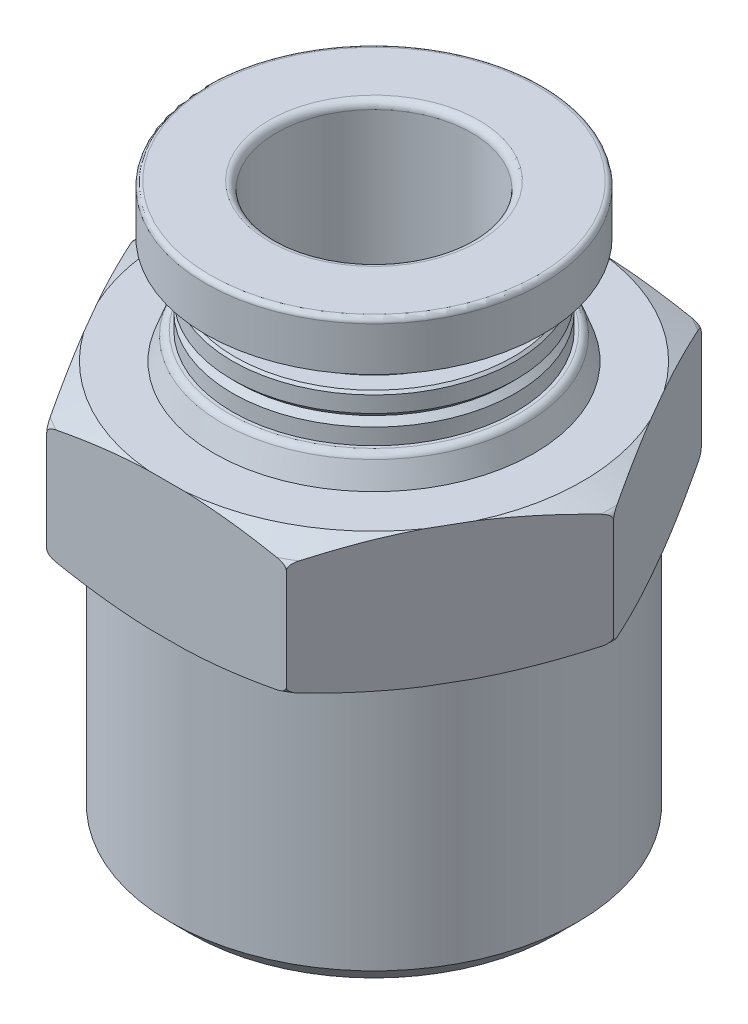
from build123d import *

# Parameters (mm, degrees)
SKETCH_2_R          = 11.814954576
CUT_EXTRUDE_1_DEPTH = 23


with BuildPart() as part:
    # 草图1 → 旋转1 (revolve)
    with BuildSketch(Plane.XY, mode=Mode.PRIVATE) as revolve_1_sk:
        with BuildLine():
            Line((3, 5), (3, 0.6))
            Line((3, 0.6), (3.6, 0))
            Line((3.6, 0), (7.475, 0))
            Line((7.475, 0), (8.331, 0.856))
            Line((8.331, 0.856), (8.331, 11))
            Line((8.331, 11), (8.534954576, 11))
            Line((8.534954576, 11), (9.629759606, 11.453483091))
            ThreePointArc((9.629759606, 11.453483091), (9.76439546, 11.563975881), (9.814954576, 11.730646951))
            Line((9.814954576, 11.730646951), (9.814954576, 15.869353049))
            ThreePointArc((9.814954576, 15.869353049), (9.76439546, 16.036024119), (9.629759606, 16.146516909))
            Line((9.629759606, 16.146516909), (8.534954576, 16.6))
            Line((8.534954576, 16.6), (6.55, 16.6))
            Line((6.55, 16.6), (6.215570396, 17.504080695))
            ThreePointArc((6.215570396, 17.504080695), (6.105632697, 17.646195256), (5.934203715, 17.7))
            Line((5.934203715, 17.7), (5.8, 17.7))
            Line((5.8, 17.7), (5.8, 18.36))
            Line((5.8, 18.36), (5.56, 18.6))
            Line((5.56, 18.6), (5.8, 18.84))
            Line((5.8, 18.84), (5.8, 19.5))
            Line((5.8, 19.5), (5.7, 19.6))
            Line((5.7, 19.6), (4.95, 19.6))
            Line((4.95, 19.6), (4.95, 21))
            Line((4.95, 21), (6.9, 21))
            Line((6.9, 21), (6.9, 22.8))
            ThreePointArc((6.9, 22.8), (6.841421356, 22.941421356), (6.7, 23))
            Line((6.7, 23), (4.3, 23))
            ThreePointArc((4.3, 23), (4.087867966, 22.912132034), (4, 22.7))
            Line((4, 22.7), (4, 5))
            Line((4, 5), (3, 5))
        make_face()
    revolve(revolve_1_sk.sketch.rotate(Axis((0, 0, 0), (0, 1, 0)), 270), axis=Axis((0, 0, 0), (0, 1, 0)))

    # 草图2 → 切除-拉伸1 (cut)
    with BuildSketch(Plane(origin=(0, 11, 0), x_dir=(1, 0, 0), z_dir=(0, 1, 0))):
        Circle(SKETCH_2_R)
        Polygon((-9.814954576, 0), (-4.907477288, -8.5), (4.907477288, -8.5), (9.814954576, 0), (4.907477288, 8.5), (-4.907477288, 8.5), align=None, mode=Mode.SUBTRACT)
    extrude(amount=CUT_EXTRUDE_1_DEPTH, mode=Mode.SUBTRACT)


solid = part.part
